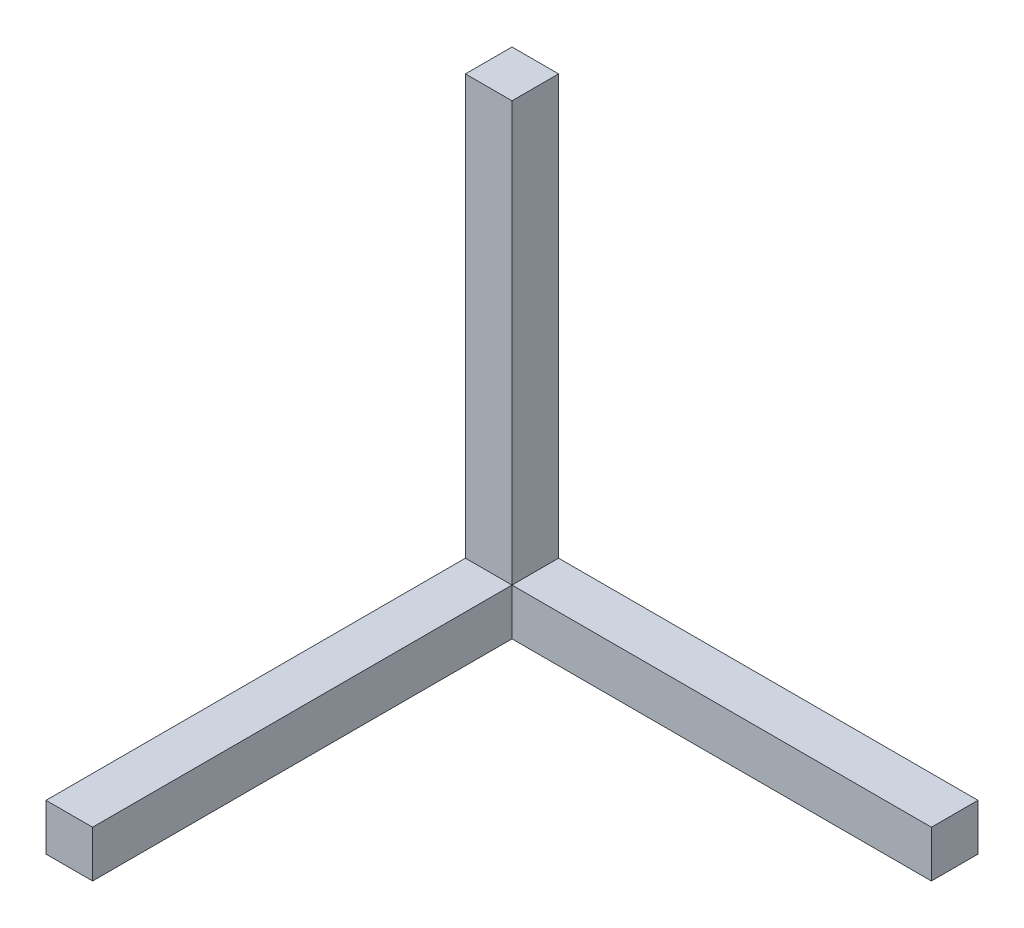
from build123d import *

# Parameters (mm, degrees)
SKETCH1_W             = 10
SKETCH1_H             = 90
BOSS_EXTRUDE1_DEPTH   = 10
SKETCH1_W_2           = 90
SKETCH1_H_2           = 10
BOSS_EXTRUDE1_2_DEPTH = 10
SKETCH1_4_W           = 10
SKETCH1_4_H           = 10
BOSS_EXTRUDE2_DEPTH   = 100


with BuildPart() as part:
    # Sketch1 → Boss-Extrude1 (new body)
    with BuildSketch(Plane.XY):
        with Locations((-97.722838733, 12.284768212)):
            Rectangle(SKETCH1_W, SKETCH1_H)
    extrude(amount=BOSS_EXTRUDE1_DEPTH)



with BuildPart() as body_2:
    # Sketch1 → Boss-Extrude1 2 (new body)
    with BuildSketch(Plane.XY):
        with Locations((-47.722838733, -37.715231788)):
            Rectangle(SKETCH1_W_2, SKETCH1_H_2)
    extrude(amount=BOSS_EXTRUDE1_2_DEPTH)


with BuildPart() as part_1:
    add(part.part)

    add(body_2.part)  # Boss-Extrude2 merges body 2
    # Sketch1<4> → Boss-Extrude2 (add)
    with BuildSketch(Plane.XY):
        with Locations((-97.722838733, -37.715231788)):
            Rectangle(SKETCH1_4_W, SKETCH1_4_H)
    extrude(amount=BOSS_EXTRUDE2_DEPTH)


solid = part_1.part
